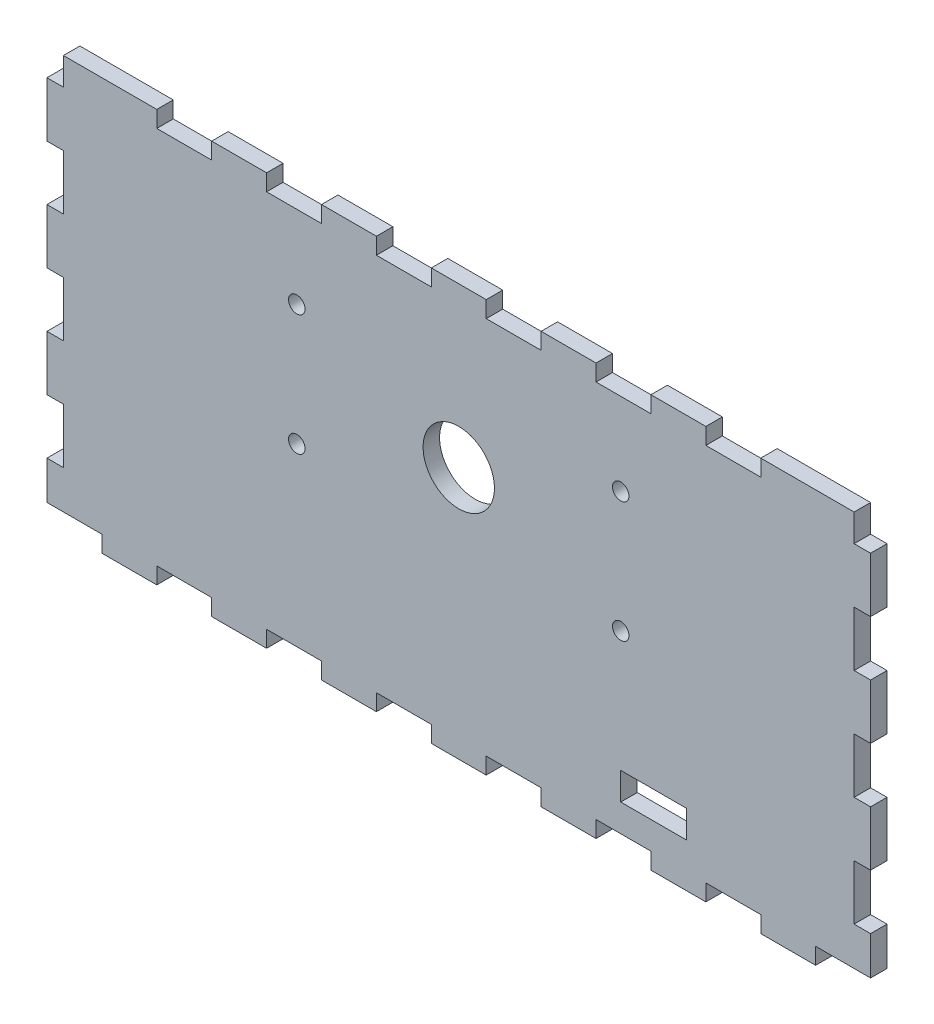
from build123d import *

# Parameters (mm, degrees)
MDFESB_W          = 150
MDFESB_H          = 75
MDF_DEPTH         = 3
ENCAIXESESB_W     = 10
ENCAIXESESB_H     = 3
ENCAIXESESB_W_2   = 3
ENCAIXESESB_H_2   = 10
ENCAIXES_DEPTH    = 3
MOTORPASSOESB_R   = 1.5
MOTORPASSOESB_R_2 = 6.5
MOTORPASSOESB_W   = 12
MOTORPASSOESB_H   = 5
MOTORPASSO_DEPTH  = 3


with BuildPart() as part:
    # mdfEsb → mdf (new body)
    with BuildSketch(Plane.XY):
        with Locations((75, 37.5)):
            Rectangle(MDFESB_W, MDFESB_H)
    extrude(amount=MDF_DEPTH)

    # EncaixesEsb → Encaixes (cut)
    with BuildSketch(Plane.XY.offset(3)):
        with Locations((25, 1.5)):
            Rectangle(ENCAIXESESB_W, ENCAIXESESB_H)
        with Locations((5, 1.5)):
            Rectangle(ENCAIXESESB_W, ENCAIXESESB_H)
        with Locations((45, 1.5)):
            Rectangle(ENCAIXESESB_W, ENCAIXESESB_H)
        with Locations((65, 1.5)):
            Rectangle(ENCAIXESESB_W, ENCAIXESESB_H)
        with Locations((85, 1.5)):
            Rectangle(ENCAIXESESB_W, ENCAIXESESB_H)
        with Locations((105, 1.5)):
            Rectangle(ENCAIXESESB_W, ENCAIXESESB_H)
        with Locations((125, 1.5)):
            Rectangle(ENCAIXESESB_W, ENCAIXESESB_H)
        with Locations((145, 1.5)):
            Rectangle(ENCAIXESESB_W, ENCAIXESESB_H)
        with Locations((1.5, 15)):
            Rectangle(ENCAIXESESB_W_2, ENCAIXESESB_H_2)
        with Locations((148.5, 15)):
            Rectangle(ENCAIXESESB_W_2, ENCAIXESESB_H_2)
        with Locations((148.5, 35)):
            Rectangle(ENCAIXESESB_W_2, ENCAIXESESB_H_2)
        with Locations((148.5, 55)):
            Rectangle(ENCAIXESESB_W_2, ENCAIXESESB_H_2)
        with Locations((148.5, 75)):
            Rectangle(ENCAIXESESB_W_2, ENCAIXESESB_H_2)
        with Locations((1.5, 35)):
            Rectangle(ENCAIXESESB_W_2, ENCAIXESESB_H_2)
        with Locations((1.5, 55)):
            Rectangle(ENCAIXESESB_W_2, ENCAIXESESB_H_2)
        with Locations((1.5, 75)):
            Rectangle(ENCAIXESESB_W_2, ENCAIXESESB_H_2)
        with Locations((25, 73.5)):
            Rectangle(ENCAIXESESB_W, ENCAIXESESB_H)
        with Locations((45, 73.5)):
            Rectangle(ENCAIXESESB_W, ENCAIXESESB_H)
        with Locations((65, 73.5)):
            Rectangle(ENCAIXESESB_W, ENCAIXESESB_H)
        with Locations((85, 73.5)):
            Rectangle(ENCAIXESESB_W, ENCAIXESESB_H)
        with Locations((105, 73.5)):
            Rectangle(ENCAIXESESB_W, ENCAIXESESB_H)
        with Locations((125, 73.5)):
            Rectangle(ENCAIXESESB_W, ENCAIXESESB_H)
    extrude(amount=-ENCAIXES_DEPTH, mode=Mode.SUBTRACT)

    # motorPassoEsb → motorPasso (cut)
    with BuildSketch(Plane.XY.offset(3)):
        with Locations((45.5, 35)):
            Circle(MOTORPASSOESB_R)
        with Locations((104.5, 35)):
            Circle(MOTORPASSOESB_R)
        with Locations((104.5, 57)):
            Circle(MOTORPASSOESB_R)
        with Locations((45.5, 57)):
            Circle(MOTORPASSOESB_R)
        with Locations((75, 46)):
            Circle(MOTORPASSOESB_R_2)
        with Locations((110.5, 10.5)):
            Rectangle(MOTORPASSOESB_W, MOTORPASSOESB_H)
    extrude(amount=-MOTORPASSO_DEPTH, mode=Mode.SUBTRACT)


solid = part.part
